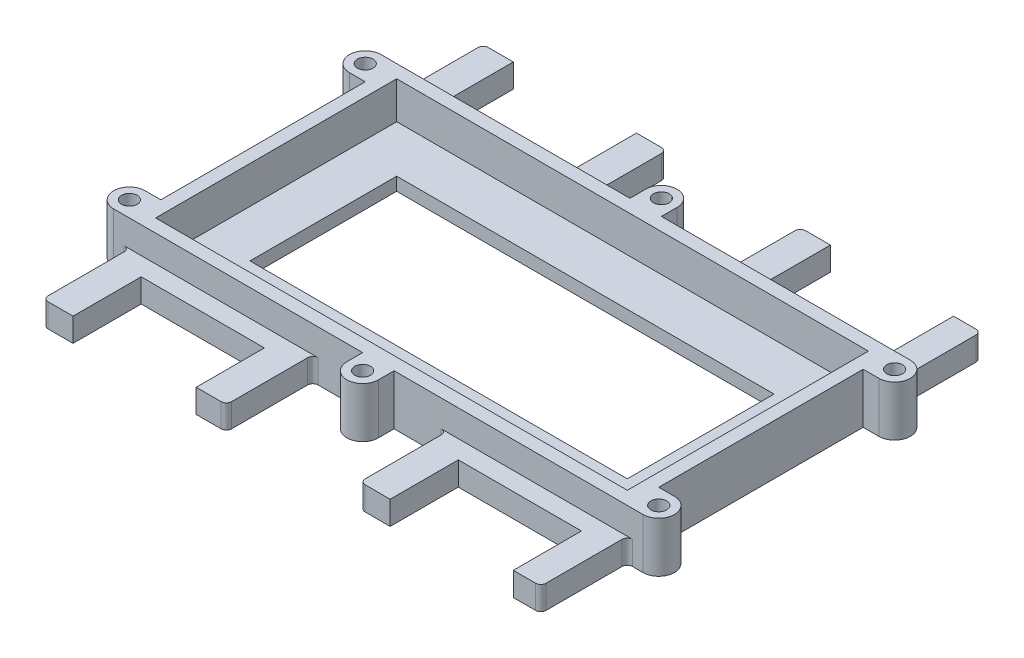
from build123d import *

# Parameters (mm, degrees)
BOSS_EXTRUDE1_DEPTH = 4.5
SKETCH2_W           = 72
SKETCH2_H           = 28
CUT_EXTRUDE1_DEPTH  = 4.5
SKETCH3_W           = 95
SKETCH3_H           = 51
SKETCH3_W_2         = 90
SKETCH3_H_2         = 46
BOSS_EXTRUDE2_DEPTH = 5.1
SKETCH4_W           = 90
SKETCH4_H           = 46
CUT_EXTRUDE2_DEPTH  = 2
SKETCH6_R           = 1.5
BOSS_EXTRUDE3_DEPTH = 9.6
FILLET1_R           = 1


with BuildPart() as part:
    # Sketch1 → Boss-Extrude1 (new body)
    with BuildSketch(Plane(origin=(0, 0, 0), x_dir=(1, 0, 0), z_dir=(0, 1, 0))):
        Polygon((-14.974237314, -43.742281537), (-14.974237314, -30.742281537), (-38.474237314, -30.742281537), (-38.474237314, -43.742281537), (-44.224237314, -43.742281537), (-44.224237314, 40.257718463), (-38.474237314, 40.257718463), (-38.474237314, 27.257718463), (-14.974237314, 27.257718463), (-14.974237314, 40.257718463), (-9.224237314, 40.257718463), (-9.224237314, 23.757718463), (16.275762686, 23.757718463), (16.275762686, 40.257718463), (22.025762686, 40.257718463), (22.025762686, 27.257718463), (45.525762686, 27.257718463), (45.525762686, 40.257718463), (50.775762686, 40.257718463), (50.775762686, -43.742281537), (45.525762686, -43.742281537), (45.525762686, -30.742281537), (22.025762686, -30.742281537), (22.025762686, -43.742281537), (16.275762686, -43.742281537), (16.275762686, -27.242281537), (-9.224237314, -27.242281537), (-9.224237314, -43.742281537), align=None)
    extrude(amount=BOSS_EXTRUDE1_DEPTH)

    # Sketch2 → Cut-Extrude1 (cut)
    with BuildSketch(Plane(origin=(0, 4.5, 0), x_dir=(1, 0, 0), z_dir=(0, 1, 0))):
        with Locations((3.275762686, -1.742281537)):
            Rectangle(SKETCH2_W, SKETCH2_H)
    extrude(amount=-CUT_EXTRUDE1_DEPTH, mode=Mode.SUBTRACT)

    # Sketch3 → Boss-Extrude2 (add)
    with BuildSketch(Plane(origin=(0, 4.5, 0), x_dir=(1, 0, 0), z_dir=(0, 1, 0))):
        with Locations((3.275762686, -1.742281537)):
            Rectangle(SKETCH3_W, SKETCH3_H)
        with Locations((3.275762686, -1.742281537)):
            Rectangle(SKETCH3_W_2, SKETCH3_H_2, mode=Mode.SUBTRACT)
    extrude(amount=BOSS_EXTRUDE2_DEPTH)

    # Sketch4 → Cut-Extrude2 (cut)
    with BuildSketch(Plane(origin=(0, 4.5, 0), x_dir=(1, 0, 0), z_dir=(0, 1, 0))):
        with Locations((3.275762686, -1.742281537)):
            Rectangle(SKETCH4_W, SKETCH4_H)
    extrude(amount=-CUT_EXTRUDE2_DEPTH, mode=Mode.SUBTRACT)

    # Sketch6 → Boss-Extrude3 (add)
    # profile 1 of 6: a face of its own
    with BuildSketch(Plane(origin=(0, 9.6, 0), x_dir=(1, 0, 0), z_dir=(0, 1, 0))):
        with BuildLine():
            Line((-44.224237314, 23.757718463), (-47.224237314, 23.757718463))
            ThreePointArc((-47.224237314, 23.757718463), (-50.224237314, 20.757718463), (-47.224237314, 17.757718463))
            Line((-47.224237314, 17.757718463), (-44.224237314, 17.757718463))
            Line((-44.224237314, 17.757718463), (-44.224237314, 23.757718463))
        make_face()
        with Locations(Location((-47.224237314, 20.757718463, 0), (0, 0, 270))):
            Circle(SKETCH6_R, mode=Mode.SUBTRACT)
    # profile 2 of 6: a face of its own
    with BuildSketch(Plane(origin=(0, 9.6, 0), x_dir=(1, 0, 0), z_dir=(0, 1, 0))):
        with BuildLine():
            Line((50.775762686, 17.757718463), (53.775762686, 17.757718463))
            ThreePointArc((53.775762686, 17.757718463), (56.775762686, 20.757718463), (53.775762686, 23.757718463))
            Line((53.775762686, 23.757718463), (50.775762686, 23.757718463))
            Line((50.775762686, 23.757718463), (50.775762686, 17.757718463))
        make_face()
        with Locations(Location((53.775762686, 20.757718463, 0), (0, 0, 90))):
            Circle(SKETCH6_R, mode=Mode.SUBTRACT)
    # profile 3 of 6: a face of its own
    with BuildSketch(Plane(origin=(0, 9.6, 0), x_dir=(1, 0, 0), z_dir=(0, 1, 0))):
        with BuildLine():
            Line((50.775762686, -27.242281537), (53.775762686, -27.242281537))
            ThreePointArc((53.775762686, -27.242281537), (56.775762686, -24.242281537), (53.775762686, -21.242281537))
            Line((53.775762686, -21.242281537), (50.775762686, -21.242281537))
            Line((50.775762686, -21.242281537), (50.775762686, -27.242281537))
        make_face()
        with Locations(Location((53.775762686, -24.242281537, 0), (0, 0, 270))):
            Circle(SKETCH6_R, mode=Mode.SUBTRACT)
    # profile 4 of 6: a face of its own
    with BuildSketch(Plane(origin=(0, 9.6, 0), x_dir=(1, 0, 0), z_dir=(0, 1, 0))):
        with BuildLine():
            Line((-44.224237314, -21.242281537), (-47.224237314, -21.242281537))
            ThreePointArc((-47.224237314, -21.242281537), (-50.224237314, -24.242281537), (-47.224237314, -27.242281537))
            Line((-47.224237314, -27.242281537), (-44.224237314, -27.242281537))
            Line((-44.224237314, -27.242281537), (-44.224237314, -21.242281537))
        make_face()
        with Locations(Location((-47.224237314, -24.242281537, 0), (0, 0, 90))):
            Circle(SKETCH6_R, mode=Mode.SUBTRACT)
    # profile 5 of 6: a face of its own
    with BuildSketch(Plane(origin=(0, 9.6, 0), x_dir=(1, 0, 0), z_dir=(0, 1, 0))):
        with BuildLine():
            Line((6.275762686, -27.242281537), (6.275762686, -30.242281537))
            ThreePointArc((6.275762686, -30.242281537), (3.275762686, -33.242281537), (0.275762686, -30.242281537))
            Line((0.275762686, -30.242281537), (0.275762686, -27.242281537))
            Line((0.275762686, -27.242281537), (6.275762686, -27.242281537))
        make_face()
        with Locations(Location((3.275762686, -30.242281537, 0), (0, 0, 90))):
            Circle(SKETCH6_R, mode=Mode.SUBTRACT)
    # profile 6 of 6: a face of its own
    with BuildSketch(Plane(origin=(0, 9.6, 0), x_dir=(1, 0, 0), z_dir=(0, 1, 0))):
        with BuildLine():
            Line((0.275762686, 23.757718463), (6.275762686, 23.757718463))
            Line((6.275762686, 23.757718463), (6.275762686, 26.757718463))
            ThreePointArc((6.275762686, 26.757718463), (3.275762686, 29.757718463), (0.275762686, 26.757718463))
            Line((0.275762686, 26.757718463), (0.275762686, 23.757718463))
        make_face()
        with Locations(Location((3.275762686, 26.757718463, 0), (0, 0, 270))):
            Circle(SKETCH6_R, mode=Mode.SUBTRACT)
    extrude(amount=-BOSS_EXTRUDE3_DEPTH)

    # Fillet1
    fillet1_edges = [part.edges().sort_by_distance(p)[0] for p in [
        (-44.224237314, 2.25, -23.757718463),
        (50.775762686, 2.25, -23.757718463),
        (50.775762686, 2.25, 27.242281537),
        (-44.224237314, 2.25, 27.242281537),
        (-44.224237314, 2.25, 43.742281537),
        (-44.224237314, 2.25, -40.257718463),
        (-9.224237314, 2.25, -40.257718463),
        (-9.224237314, 2.25, -23.757718463),
        (16.275762686, 2.25, -23.757718463),
        (16.275762686, 2.25, -40.257718463),
        (50.775762686, 2.25, -40.257718463),
        (50.775762686, 2.25, 43.742281537),
        (16.275762686, 2.25, 43.742281537),
        (16.275762686, 2.25, 27.242281537),
        (-9.224237314, 2.25, 27.242281537),
        (-9.224237314, 2.25, 43.742281537),
    ]]
    fillet(fillet1_edges, radius=FILLET1_R)


solid = part.part
